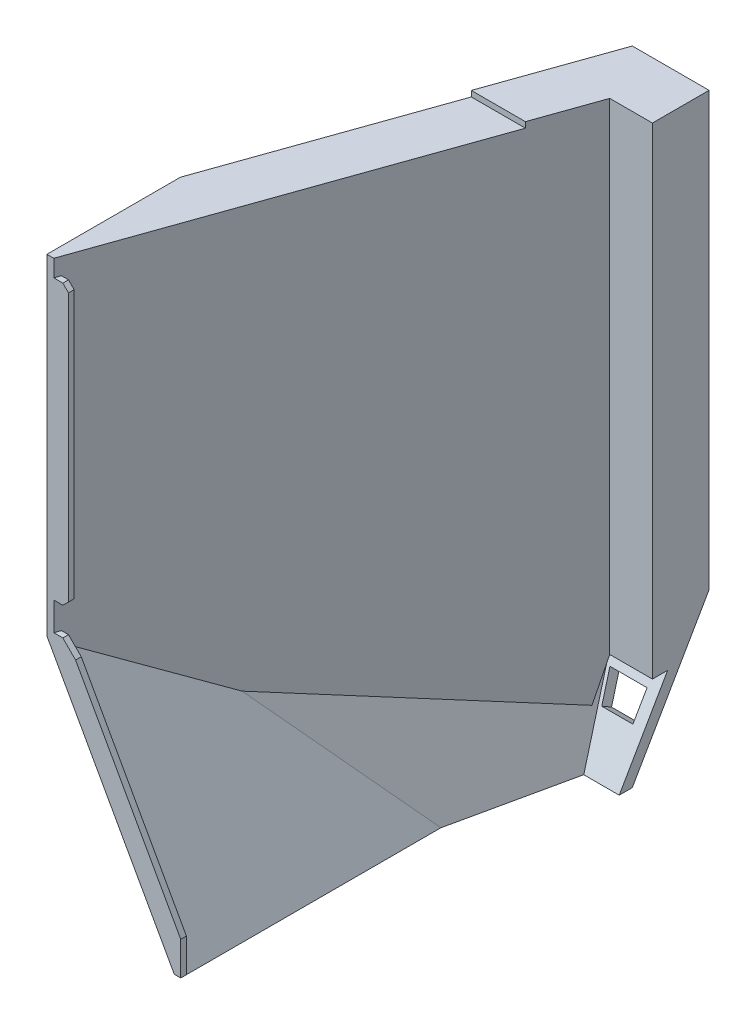
from build123d import *
from OCP.BRepFilletAPI import BRepFilletAPI_MakeChamfer

# Parameters (mm, degrees)
BOSS_EXTRU_2_DEPTH            = 850
ESQUISSE2_W                   = 135.455554094
ESQUISSE2_H                   = 850
BOSS_EXTRU_4_DEPTH            = 100
ESQUISSE7_W                   = 615
ESQUISSE7_H                   = 10
ENL_V_MAT_EXTRU_5_DEPTH       = 1260.158602645
ENL_V_MAT_EXTRU_6_DEPTH       = 1237.105055174
CHANFREIN1_SIZE               = 40
CHANFREIN1_SIZE2              = 104.203562588
CHANFREIN2_SIZE               = 50
CHANFREIN2_SIZE2              = 86.602540378
CHANFREIN3_SIZE               = 250
CHANFREIN3_SIZE2              = 81.394715296
ENL_V_MAT_EXTRU_9_DEPTH       = 20
BOSS_EXTRU_5_DEPTH            = 20
BOSS_EXTRU_6_DEPTH            = 20
BOSS_EXTRU_7_DEPTH            = 20
BOSS_EXTRU_8_REACH            = 1235.856
BOSS_EXTRU_14_REACH           = 1078.841
ENL_V_MAT_EXTRU_11_DEPTH      = 1231.067968745
ENL_V_MAT_EXTRU_11_DEPTH_BACK = 1231.067968745
ESQUISSE20_W                  = 36.798592216
ESQUISSE20_H                  = 35.835276246
ENL_V_MAT_EXTRU_10_DEPTH      = 1231.067968745
ENL_V_MAT_EXTRU_10_DEPTH_BACK = 1231.067968745
BOSS_EXTRU_15_DEPTH           = 10
ENL_V_MAT_EXTRU_12_DEPTH      = 1231.067968745
BOSS_EXTRU_17_DEPTH           = 10
ENL_V_MAT_EXTRU_13_DEPTH      = 10
CHANFREIN6_SIZE               = 10
CHANFREIN6_SIZE2              = 25.739216822
ENL_V_MAT_EXTRU_7_DEPTH       = 20
ESQUISSE28_W                  = 50.106872135
ESQUISSE28_H                  = 235.71179502
ENL_V_MAT_EXTRU_15_DEPTH      = 1231.067968745
ESQUISSE29_W                  = 637.847110701
ESQUISSE29_H                  = 1293.268515121
ENL_V_MAT_EXTRU_16_DEPTH      = 1461.464477458


with BuildPart() as part:
    # Esquisse1 → Boss.-Extru.2 (new body)
    with BuildSketch(Plane(origin=(0, 0, 0), x_dir=(1, 0, 0), z_dir=(0, 1, 0))):
        Polygon((0, 0), (95.455554093, 0), (-196.119788372, 825), (-291.575342466, 825), align=None)
    extrude(amount=BOSS_EXTRU_2_DEPTH)

    # Esquisse2 → Boss.-Extru.4 (add)
    with BuildSketch(Plane(origin=(0, 0, -825), x_dir=(-1, 0, 0), z_dir=(0, 0, -1))):
        with Locations((263.847565419, 425)):
            Rectangle(ESQUISSE2_W, ESQUISSE2_H)
    extrude(amount=-BOSS_EXTRU_4_DEPTH)

    # Esquisse7 → Enlèv. mat.-Extru.5 (cut, through all)
    with BuildSketch(Plane.ZY.offset(331.575342466)):
        with Locations((-307.5, 845)):
            Rectangle(ESQUISSE7_W, ESQUISSE7_H)
    extrude(amount=-ENL_V_MAT_EXTRU_5_DEPTH, mode=Mode.SUBTRACT)

    # Esquisse8 → Enlèv. mat.-Extru.6 (cut, through all)
    with BuildSketch(Plane(origin=(84.856246207, 0, -29.990289755), x_dir=(-0.3332254417270876, 0, -0.9428471800805194), z_dir=(0.9428471800805194, 0, -0.3332254417270876))):
        Polygon((-31.808219178, 280), (768.947519086, 0), (-31.808219178, 0), align=None)
    extrude(amount=-ENL_V_MAT_EXTRU_6_DEPTH, mode=Mode.SUBTRACT)

    # Chanfrein1
    chanfrein1_edges = [part.edges().sort_by_distance(p)[0] for p in [
        (-37.960538206, 140, -377.495144878),
    ]]
    chanfrein1_side = [part.faces().sort_by_distance(p)[0] for p in [
        (-82.734004125, 137.238189401, -370.048215647),
    ]]
    chamfer(chanfrein1_edges, length=CHANFREIN1_SIZE, length2=CHANFREIN1_SIZE2, reference=chanfrein1_side[0])

    # Chanfrein2
    chanfrein2_edges = [part.edges().sort_by_distance(p)[0] for p in [
        (-279.375357295, 0, -825),
    ]]
    chanfrein2_side = [part.faces().sort_by_distance(p)[0] for p in [
        (-275.691218494, 0, -775.06397156),
    ]]
    chamfer(chanfrein2_edges, length=CHANFREIN2_SIZE, length2=CHANFREIN2_SIZE2, reference=chanfrein2_side[0])

    # Chanfrein3
    chanfrein3_edges = [part.edges().sort_by_distance(p)[0] for p in [
        (95.455554093, 615.195164523, 0),
    ]]
    chanfrein3_side = [part.faces().sort_by_distance(p)[0] for p in [
        (-63.074276605, 533.547742021, -448.553396936),
    ]]
    chamfer(chanfrein3_edges, length=CHANFREIN3_SIZE, length2=CHANFREIN3_SIZE2, reference=chanfrein3_side[0])

    # Esquisse11 → Enlèv. mat.-Extru.9 (cut)
    with BuildSketch(Plane(origin=(0, 0, -825), x_dir=(-1, 0, 0), z_dir=(0, 0, -1))):
        with BuildLine():
            Line((273.165439889, 663.862320377), (222.709885796, 714.31787447))
            ThreePointArc((222.709885796, 714.31787447), (222.709885796, 746.137679623), (254.529690949, 746.137679623))
            Line((254.529690949, 746.137679623), (304.985245042, 695.68212553))
            ThreePointArc((304.985245042, 695.68212553), (304.985245042, 663.862320377), (273.165439889, 663.862320377))
        make_face()
        with BuildLine():
            Line((273.165439889, 523.862320377), (222.709885796, 574.31787447))
            ThreePointArc((222.709885796, 574.31787447), (222.709885796, 606.137679623), (254.529690949, 606.137679623))
            Line((254.529690949, 606.137679623), (304.985245042, 555.68212553))
            ThreePointArc((304.985245042, 555.68212553), (304.985245042, 523.862320377), (273.165439889, 523.862320377))
        make_face()
        with BuildLine():
            Line((273.165439889, 383.862320377), (222.709885796, 434.31787447))
            ThreePointArc((222.709885796, 434.31787447), (222.709885796, 466.137679623), (254.529690949, 466.137679623))
            Line((254.529690949, 466.137679623), (304.985245042, 415.68212553))
            ThreePointArc((304.985245042, 415.68212553), (304.985245042, 383.862320377), (273.165439889, 383.862320377))
        make_face()
        with BuildLine():
            Line((273.165439889, 243.862320377), (222.709885796, 294.31787447))
            ThreePointArc((222.709885796, 294.31787447), (222.709885796, 326.137679623), (254.529690949, 326.137679623))
            Line((254.529690949, 326.137679623), (304.985245042, 275.68212553))
            ThreePointArc((304.985245042, 275.68212553), (304.985245042, 243.862320377), (273.165439889, 243.862320377))
        make_face()
    extrude(amount=-ENL_V_MAT_EXTRU_9_DEPTH, mode=Mode.SUBTRACT)

    # Esquisse12 → Boss.-Extru.5 (add)
    with BuildSketch(Plane(origin=(-40.719657631, 14.978452192, 8.836336942), x_dir=(-0.1789623557208966, 0.09138543974154965, -0.9796025605509977), z_dir=(0.9196400605905344, -0.33828341108028354, -0.19956576045235425))):
        Polygon((758.2962151, -87.760898196), (129.510578012, 220.360980406), (128.5939647, -274.639019594), (551.387234827, -304.990440115), align=None)
    extrude(amount=-BOSS_EXTRU_5_DEPTH)

    # Esquisse13 → Boss.-Extru.6 (add)
    with BuildSketch(Plane(origin=(0, -335.584843966, -581.25), x_dir=(-1, 0, 0), z_dir=(0, -0.5000000000000013, -0.8660254037844379))):
        Polygon((331.575342466, 387.5), (216.325161863, 387.5), (331.575342466, -161.154885751), align=None)
    extrude(amount=-BOSS_EXTRU_6_DEPTH)

    # Esquisse14 → Boss.-Extru.7 (add)
    with BuildSketch(Plane(origin=(-40.719657631, 14.978452192, 8.836336942), x_dir=(0.18729623755068028, -0.06889566128781024, 0.9798844356632441), z_dir=(-0.9196400605905354, 0.33828341108028165, 0.19956576045235197))):
        Polygon((-558.543564559, -291.678140731), (-760.182954736, -69.548547185), (-765.904204326, -72.183872894), (-799.927326543, -74.681473645), (-671.74280044, -297.07939729), align=None)
    extrude(amount=BOSS_EXTRU_7_DEPTH)

    # Boss.-Extru.8: up to this face of the body (flat: up to its plane)
    boss_extru_8_end = Plane(part.part.faces().sort_by_distance((-164.532158793, -37.982859016, -371.724952169))[0])
    # Esquisse17 → Boss.-Extru.8 (add, up to the picked face)
    with BuildSketch(Plane(origin=(14.059914026, 0, -0.114027244), x_dir=(-0.008109828661301803, 0, -0.9999671147988239), z_dir=(0.999967114798824, 0, -0.008109828661301803)), mode=Mode.PRIVATE) as boss_extru_8_sk1:
        Polygon((0, 268.877630288), (0, -254.375489576), (124.880630316, -230.495880912), (112.743376241, 233.203159991), align=None)
    boss_extru_8_tool1 = split(extrude(boss_extru_8_sk1.sketch, amount=-BOSS_EXTRU_8_REACH, mode=Mode.PRIVATE), bisect_by=boss_extru_8_end, keep=Keep.BOTH, mode=Mode.PRIVATE)
    add(boss_extru_8_tool1.solids().sort_by(Axis((13.587491, -0.094835, -58.365221), (-0.999967114798824, 0, 0.008109828661301803)))[0])

    # Boss.-Extru.14: up to this face of the body (flat: up to its plane)
    boss_extru_14_end = Plane(part.part.faces().sort_by_distance((-146.671728248, -30.602018057, -301.931660273))[0])
    # Esquisse19 → Boss.-Extru.14 (add, up to the picked face)
    with BuildSketch(Plane(origin=(-27.916044034, 239.583966402, -78.987256375), x_dir=(-0.9939328490713287, -0.1044581087967751, 0.034438278754206304), z_dir=(0.1099885973042266, -0.9439555392983614, 0.31120804663599005)), mode=Mode.PRIVATE) as boss_extru_14_sk1:
        Polygon((-42.23311753, -84.700642173), (-41.849173409, -35.141174806), (202.602212611, 697.589071061), (229.71052108, 688.54527409), (-28.086448758, -84.187661354), align=None)
    boss_extru_14_tool1 = split(extrude(boss_extru_14_sk1.sketch, amount=BOSS_EXTRU_14_REACH, mode=Mode.PRIVATE), bisect_by=boss_extru_14_end, keep=Keep.BOTH, mode=Mode.PRIVATE)
    add(boss_extru_14_tool1.solids().sort_by(Axis((-116.11325, 133.026087, -371.027306), (0.1099885973042266, -0.9439555392983614, 0.31120804663599005)))[0])

    # Esquisse20 → Enlèv. mat.-Extru.11 (cut, two sides: drawn at the far end of the back side and taken through both)
    with BuildSketch(Plane(origin=(0, 0, 0), x_dir=(1, 0, 0), z_dir=(0, 1, 0)).offset(-ENL_V_MAT_EXTRU_11_DEPTH_BACK)):
        with Locations((-4.33845731, -17.917638123)):
            Rectangle(ESQUISSE20_W, ESQUISSE20_H)
    extrude(amount=ENL_V_MAT_EXTRU_11_DEPTH + ENL_V_MAT_EXTRU_11_DEPTH_BACK, mode=Mode.SUBTRACT)

    # Esquisse15 → Enlèv. mat.-Extru.10 (cut, two sides: drawn at the far end of the back side and taken through both)
    with BuildSketch(Plane.XY.offset(-ENL_V_MAT_EXTRU_10_DEPTH_BACK)):
        Polygon((-331.575342466, -190.149068971), (-331.575342466, -475.149068971), (14.059914026, -475.149068971), (14.059914026, -190.149068971), (55.846885337, -190.149068971), (55.846885337, 19.850931029), (55.846885337, 270.515982808), (14.060838798, 270.515982808), (14.060838798, 259.850931029), (-235.940085974, -190.149068971), align=None)
    extrude(amount=ENL_V_MAT_EXTRU_10_DEPTH + ENL_V_MAT_EXTRU_10_DEPTH_BACK, mode=Mode.SUBTRACT)

    # Esquisse21 → Boss.-Extru.15 (add)
    with BuildSketch(Plane(origin=(-99.569705588, 55.316707725, 0), x_dir=(0, 0, -1), z_dir=(0.8741565134833756, -0.4856443039247848, 0))):
        Polygon((321.424737861, -305.542159578), (543.068402305, -280.803005995), (155.773656423, 231.37758287), (0, 233.978950164), (0, 205.025992858), (0, -305.542159578), align=None)
    extrude(amount=-BOSS_EXTRU_15_DEPTH)

    # Esquisse23 → Enlèv. mat.-Extru.12 (cut, through all)
    with BuildSketch(Plane.XY):
        Polygon((-331.575342466, -190.149068971), (-331.575342466, -260.816411821), (-102.082537534, -260.816411821), (-102.082537534, -190.149068971), (-102.082537534, -148.149068971), (-331.575342466, -148.149068971), align=None)
    extrude(amount=-ENL_V_MAT_EXTRU_12_DEPTH, mode=Mode.SUBTRACT)

    # Esquisse26 → Boss.-Extru.17 (add)
    with BuildSketch(Plane.XY):
        Polygon((14.060838798, 810), (14.060838798, 317.576928865), (-25.939161202, 317.576928865), (-25.939161202, 810), (0, 810), (0, 840), (14.060838798, 840), align=None)
        Polygon((-25.939161202, 267.576928865), (14.060838798, 267.576928865), (12.797499589, 257.576928865), (-212.606666329, -148.149068971), (-224.046265355, -148.149068971), (-224.046265355, -89.014539546), align=None)
    extrude(amount=-BOSS_EXTRU_17_DEPTH)

    # Esquisse24 → Enlèv. mat.-Extru.13 (cut)
    with BuildSketch(Plane(origin=(14.059914026, 0, -0.114027244), x_dir=(-0.008109828661301803, 0, -0.9999671147988239), z_dir=(0.999967114798824, 0, -0.008109828661301803))):
        Polygon((-0.114030993, 259.850931029), (155.664748246, 257.576928865), (235.605515711, 302.972909907), (235.605515711, 840), (-0.114030993, 840), align=None)
    extrude(amount=ENL_V_MAT_EXTRU_13_DEPTH, mode=Mode.SUBTRACT)

    # Chanfrein6: one chamfer whose edges measure the first distance from different faces: ONE call of the kernel's chamfer builder (chamfer() names one face for all edges)
    chanfrein6_edges_1 = [part.edges().sort_by_distance(p)[0] for p in [
        (-25.939161202, 267.576928865, -5),
    ]]
    chanfrein6_side_1 = [part.faces().sort_by_distance(p)[0] for p in [
        (-13.831610998, 267.576928865, -4.878156509),
    ]]
    chanfrein6_edges_2 = [part.edges().sort_by_distance(p)[0] for p in [
        (-25.939161202, 810, -5),
        (-25.939161202, 317.576928865, -5),
    ]]
    chanfrein6 = BRepFilletAPI_MakeChamfer(part.part.solid().wrapped)
    for e in chanfrein6_edges_1:
        chanfrein6.Add(CHANFREIN6_SIZE, CHANFREIN6_SIZE2, e.wrapped, chanfrein6_side_1[0].wrapped)  # the first distance lies on this face
    for e in chanfrein6_edges_2:
        chanfrein6.Add(CHANFREIN6_SIZE, e.wrapped)
    add(Compound.cast(chanfrein6.Shape()), mode=Mode.REPLACE)

    # Esquisse9 → Enlèv. mat.-Extru.7 (cut)
    with BuildSketch(Plane(origin=(0, -335.584843966, -581.25), x_dir=(-1, 0, 0), z_dir=(0, -0.49999999999999656, -0.8660254037844407))):
        Polygon((311.575342466, 438.386921888), (226.072366588, 438.386921888), (236.575342466, 388.386921888), (311.575342466, 388.386921888), align=None)
        Polygon((311.575342466, 343.175811089), (246.072366588, 343.175811089), (256.575342466, 293.175811089), (311.575342466, 293.175811089), align=None)
    extrude(amount=-ENL_V_MAT_EXTRU_7_DEPTH, mode=Mode.SUBTRACT)

    # Esquisse28 → Enlèv. mat.-Extru.15 (cut, through all)
    with BuildSketch(Plane(origin=(0, 0, 0), x_dir=(1, 0, 0), z_dir=(0, 1, 0))):
        with Locations((37.20262973, 117.85589751)):
            Rectangle(ESQUISSE28_W, ESQUISSE28_H)
    extrude(amount=ENL_V_MAT_EXTRU_15_DEPTH, mode=Mode.SUBTRACT)

    # Symétrie1: part across plane


with BuildPart() as part_1:
    add(part.part)
    add(part.part.mirror(Plane(origin=(-331.575342466, 0, -725), x_dir=(0, 0, 1), z_dir=(-1, 0, 0))))

    # Esquisse29 → Enlèv. mat.-Extru.16 (cut, through all)
    with BuildSketch(Plane(origin=(0, 850, 0), x_dir=(1, 0, 0), z_dir=(0, 1, 0))):
        with Locations((-12.651787115, 178.365742439)):
            Rectangle(ESQUISSE29_W, ESQUISSE29_H)
    extrude(amount=-ENL_V_MAT_EXTRU_16_DEPTH, mode=Mode.SUBTRACT)


solid = part_1.part
